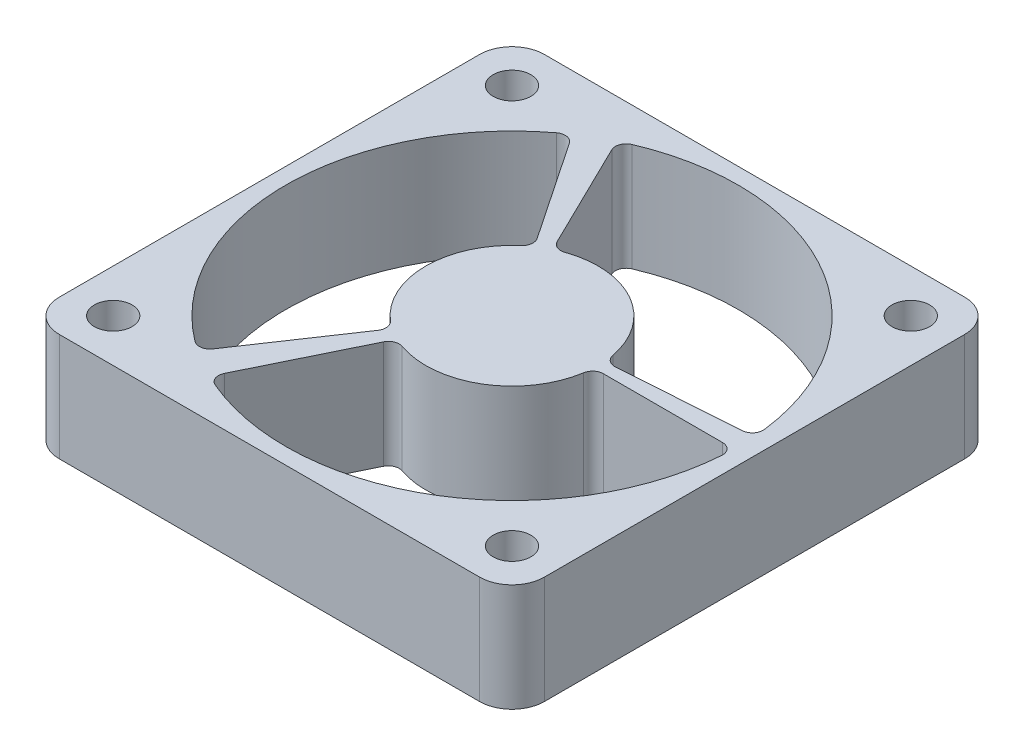
from build123d import *

# Parameters (mm, degrees)
DODANIE_WYCI_GNI_CIE1_DEPTH = 10
SZKIC2_R                    = 1.75
WYTNIJ_WYCI_GNI_CIE1_DEPTH  = 10


with BuildPart() as part:
    # Szkic1 → Dodanie-wyciągnięcie1 (new body)
    with BuildSketch(Plane(origin=(0, 0, 0), x_dir=(1, 0, 0), z_dir=(0, 1, 0))):
        with BuildLine():
            Line((19.5, -22.5), (-19.5, -22.5))
            ThreePointArc((-19.5, -22.5), (-21.621320344, -21.621320344), (-22.5, -19.5))
            Line((-22.5, -19.5), (-22.5, 19.5))
            ThreePointArc((-22.5, 19.5), (-21.621320344, 21.621320344), (-19.5, 22.5))
            Line((-19.5, 22.5), (19.5, 22.5))
            ThreePointArc((19.5, 22.5), (21.621320344, 21.621320344), (22.5, 19.5))
            Line((22.5, 19.5), (22.5, -19.5))
            ThreePointArc((22.5, -19.5), (21.621320344, -21.621320344), (19.5, -22.5))
        make_face()
    extrude(amount=DODANIE_WYCI_GNI_CIE1_DEPTH)

    # Szkic2 → Wytnij-wyciągnięcie1 (cut)
    with BuildSketch(Plane(origin=(0, 10, 0), x_dir=(1, 0, 0), z_dir=(0, 1, 0))):
        with Locations(Location((-18.5, 18.5, 0), (0, 0, 270))):
            Circle(SZKIC2_R)
        with Locations(Location((18.5, 18.5, 0), (0, 0, 270))):
            Circle(SZKIC2_R)
        with Locations(Location((18.5, -18.5, 0), (0, 0, 270))):
            Circle(SZKIC2_R)
        with Locations(Location((-18.5, -18.5, 0), (0, 0, 270))):
            Circle(SZKIC2_R)
        with BuildLine():
            Line((19.949804326, -0.416088747), (8.887895851, -0.416088747))
            ThreePointArc((8.887895851, -0.416088747), (8.238797705, -0.655384076), (7.900351868, -1.258745553))
            ThreePointArc((7.900351868, -1.258745553), (4.101739563, -6.868459256), (-2.638482905, -7.552377636))
            ThreePointArc((-2.638482905, -7.552377636), (-3.348489276, -7.571518902), (-3.866696101, -8.057252494))
            Line((-3.866696101, -8.057252494), (-8.71289149, -17.970981564))
            ThreePointArc((-8.71289149, -17.970981564), (-8.751315605, -18.759947091), (-8.20521309, -19.330661607))
            ThreePointArc((-8.20521309, -19.330661607), (10.963128103, -17.911164736), (20.947294543, -1.486893185))
            ThreePointArc((20.947294543, -1.486893185), (20.681516168, -0.734474647), (19.949804326, -0.416088747))
        make_face()
        with BuildLine():
            Line((19.918829975, 1.449846448), (8.910113622, 0.686816973))
            ThreePointArc((8.910113622, 0.686816973), (8.230490402, 0.892390127), (7.858638328, 1.497265385))
            ThreePointArc((7.858638328, 1.497265385), (3.997324324, 6.929747344), (-2.638482905, 7.552377636))
            ThreePointArc((-2.638482905, 7.552377636), (-3.348489276, 7.571518902), (-3.866696101, 8.057252494))
            Line((-3.866696101, 8.057252494), (-8.71289149, 17.970981564))
            ThreePointArc((-8.71289149, 17.970981564), (-8.751315605, 18.759947091), (-8.20521309, 19.330661607))
            ThreePointArc((-8.20521309, 19.330661607), (10.495454585, 18.189157019), (20.842168696, 2.569825685))
            ThreePointArc((20.842168696, 2.569825685), (20.621275551, 1.81133417), (19.918829975, 1.449846448))
        make_face()
        with BuildLine():
            Line((-11.206880821, -16.531076152), (-5.044437294, -7.377283299))
            ThreePointArc((-5.044437294, -7.377283299), (-4.882883076, -6.685636228), (-5.221309439, -6.061182041))
            ThreePointArc((-5.221309439, -6.061182041), (-8, 0), (-5.221309439, 6.061182041))
            ThreePointArc((-5.221309439, 6.061182041), (-4.882883076, 6.685636228), (-5.044437294, 7.377283299))
            Line((-5.044437294, 7.377283299), (-11.206880821, 16.531076152))
            ThreePointArc((-11.206880821, 16.531076152), (-11.870932952, 16.958835176), (-12.638237478, 16.771253783))
            ThreePointArc((-12.638237478, 16.771253783), (-21, 0), (-12.638237478, -16.771253783))
            ThreePointArc((-12.638237478, -16.771253783), (-11.870932952, -16.958835176), (-11.206880821, -16.531076152))
        make_face()
    extrude(amount=-WYTNIJ_WYCI_GNI_CIE1_DEPTH, mode=Mode.SUBTRACT)


solid = part.part
